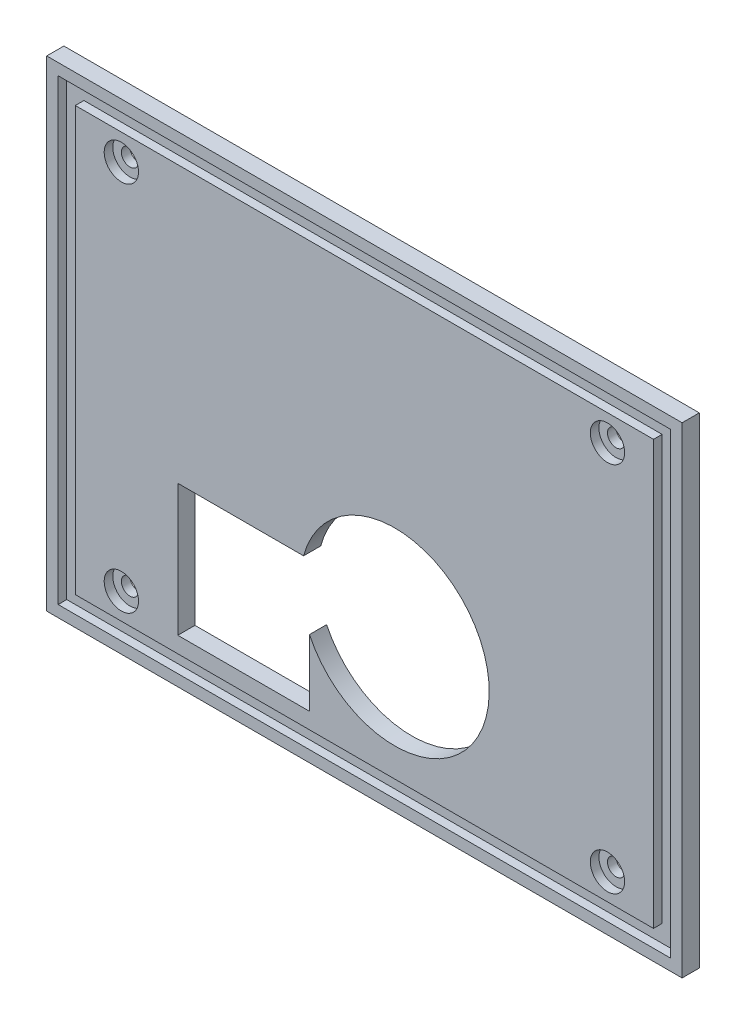
from build123d import *

# Parameters (mm, degrees)
SKETCH_9_W                                     = 111
SKETCH_9_H                                     = 84
BOTTOM_BASE_1P5MM_FULL_111X84_DEPTH            = 1.5
SKETCH_10_W                                    = 101
SKETCH_10_H                                    = 74
SKETCH_10_R                                    = 3
BOTTOM_CENTER_FULL_THICKNESS_EXCEPT_STAN_DEPTH = 3
SKETCH_11_W                                    = 111
SKETCH_11_H                                    = 2
BOTTOM_OUTER_FRONT_OVERHANG_FULL_3MM_DEPTH     = 3
SKETCH_12_W                                    = 111
SKETCH_12_H                                    = 2
BOTTOM_OUTER_REAR_OVERHANG_FULL_3MM_DEPTH      = 3
SKETCH_13_W                                    = 2
SKETCH_13_H                                    = 80
BOTTOM_OUTER_LEFT_OVERHANG_FULL_3MM_DEPTH      = 3
SKETCH_14_W                                    = 2
SKETCH_14_H                                    = 80
BOTTOM_OUTER_RIGHT_OVERHANG_FULL_3MM_DEPTH     = 3
SKETCH_16_R                                    = 1.5
BOTTOM_M3_THROUGH_3MM_DEPTH                    = 1.5
SKETCH_18_R                                    = 16.5
BOTTOM_BATTERY_THROUGH_CLEARANCE_DEPTH         = 3
SKETCH_20_W                                    = 23
SKETCH_20_H                                    = 23
BOTTOM_BUZZER_THROUGH_CUT_DEPTH                = 3


with BuildPart() as part:
    # Эскиз9 → bottom_base_1p5mm_full_111x84 (new body)
    with BuildSketch(Plane.XY):
        with Locations((53.5, 40)):
            Rectangle(SKETCH_9_W, SKETCH_9_H)
    extrude(amount=BOTTOM_BASE_1P5MM_FULL_111X84_DEPTH)

    # Эскиз10 → bottom_center_full_thickness_except_standoff_pockets (add)
    with BuildSketch(Plane.XY):
        with Locations((53.5, 40)):
            Rectangle(SKETCH_10_W, SKETCH_10_H)
        with Locations(Location((11.04, 7.54, 0), (0, 0, 180))):
            Circle(SKETCH_10_R, mode=Mode.SUBTRACT)
        with Locations(Location((95.96, 7.54, 0), (0, 0, 180))):
            Circle(SKETCH_10_R, mode=Mode.SUBTRACT)
        with Locations(Location((11.04, 72.46, 0), (0, 0, 180))):
            Circle(SKETCH_10_R, mode=Mode.SUBTRACT)
        with Locations(Location((95.96, 72.46, 0), (0, 0, 180))):
            Circle(SKETCH_10_R, mode=Mode.SUBTRACT)
    extrude(amount=BOTTOM_CENTER_FULL_THICKNESS_EXCEPT_STAN_DEPTH)

    # Эскиз11 → bottom_outer_front_overhang_full_3mm (add)
    with BuildSketch(Plane.XY):
        with Locations((53.5, -1)):
            Rectangle(SKETCH_11_W, SKETCH_11_H)
    extrude(amount=BOTTOM_OUTER_FRONT_OVERHANG_FULL_3MM_DEPTH)

    # Эскиз12 → bottom_outer_rear_overhang_full_3mm (add)
    with BuildSketch(Plane.XY):
        with Locations((53.5, 81)):
            Rectangle(SKETCH_12_W, SKETCH_12_H)
    extrude(amount=BOTTOM_OUTER_REAR_OVERHANG_FULL_3MM_DEPTH)

    # Эскиз13 → bottom_outer_left_overhang_full_3mm (add)
    with BuildSketch(Plane.XY):
        with Locations((-1, 40)):
            Rectangle(SKETCH_13_W, SKETCH_13_H)
    extrude(amount=BOTTOM_OUTER_LEFT_OVERHANG_FULL_3MM_DEPTH)

    # Эскиз14 → bottom_outer_right_overhang_full_3mm (add)
    with BuildSketch(Plane.XY):
        with Locations((108, 40)):
            Rectangle(SKETCH_14_W, SKETCH_14_H)
    extrude(amount=BOTTOM_OUTER_RIGHT_OVERHANG_FULL_3MM_DEPTH)

    # Эскиз16 → bottom_m3_through_3mm (cut)
    with BuildSketch(Plane.XY):
        with Locations(Location((11.04, 7.54, 0), (0, 0, 180))):
            Circle(SKETCH_16_R)
        with Locations(Location((95.96, 7.54, 0), (0, 0, 180))):
            Circle(SKETCH_16_R)
        with Locations(Location((11.04, 72.46, 0), (0, 0, 180))):
            Circle(SKETCH_16_R)
        with Locations(Location((95.96, 72.46, 0), (0, 0, 180))):
            Circle(SKETCH_16_R)
    extrude(amount=BOTTOM_M3_THROUGH_3MM_DEPTH, mode=Mode.SUBTRACT)

    # Эскиз18 → bottom_battery_through_clearance (cut)
    with BuildSketch(Plane.XY):
        with Locations(Location((58.8, 24.5, 0), (0, 0, 180))):
            Circle(SKETCH_18_R)
    extrude(amount=BOTTOM_BATTERY_THROUGH_CLEARANCE_DEPTH, mode=Mode.SUBTRACT)

    # Эскиз20 → bottom_buzzer_through_cut (cut)
    with BuildSketch(Plane.XY):
        with Locations((32.4, 17.3)):
            Rectangle(SKETCH_20_W, SKETCH_20_H)
    extrude(amount=BOTTOM_BUZZER_THROUGH_CUT_DEPTH, mode=Mode.SUBTRACT)


solid = part.part
